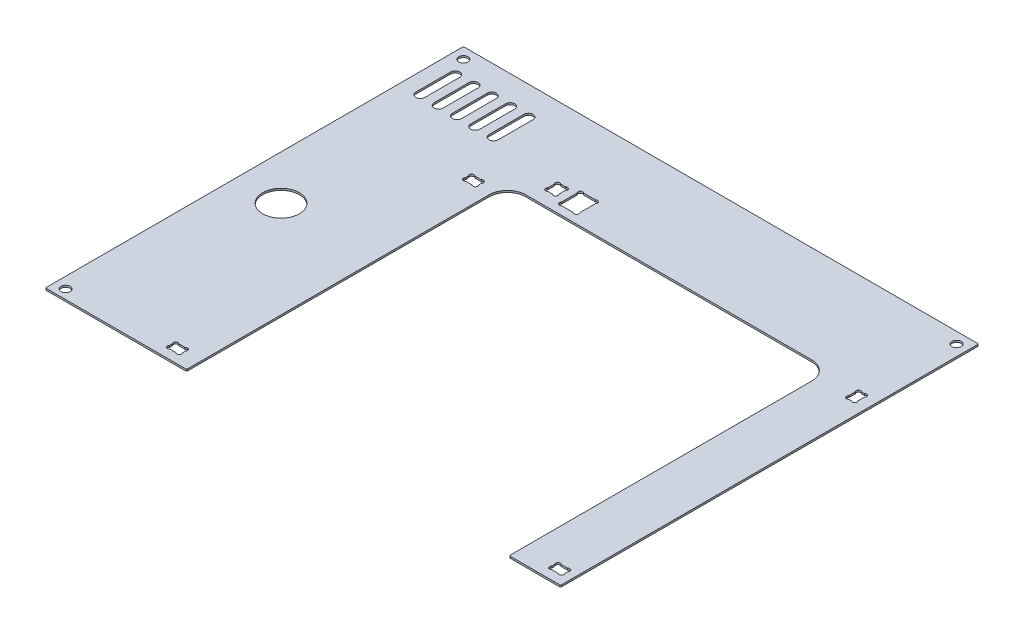
from build123d import *

# Parameters (mm, degrees)
SKETCH1_R           = 10
SKETCH1_R_2         = 2.5
SKETCH1_W           = 7
SKETCH1_H           = 5
SKETCH1_W_2         = 5
SKETCH1_H_2         = 7
BOSS_EXTRUDE1_DEPTH = 1
FILLET1_R           = 10
CUT_EXTRUDE3_DEPTH  = 362.864615568
SKETCH6_W           = 10
SKETCH6_H           = 12
CUT_EXTRUDE5_DEPTH  = 10
SKETCH7_W           = 6
SKETCH7_H           = 7
CUT_EXTRUDE6_DEPTH  = 362.864615568
SKETCH3_R           = 1.25
CUT_EXTRUDE2_DEPTH  = 362.864615568
FILLET2_R           = 0.5


with BuildPart() as part:
    # Sketch1 → Boss-Extrude1 (new body)
    with BuildSketch(Plane(origin=(0, 0, 0), x_dir=(1, 0, 0), z_dir=(0, 1, 0))):
        Polygon((77, 0), (77, 175), (253, 175), (253, 0), (281, 0), (281, 228), (0, 228), (0, 0), align=None)
        with Locations(Location((24.25, 104.25, 0), (0, 0, 270))):
            Circle(SKETCH1_R, mode=Mode.SUBTRACT)
        with Locations(Location((6, 222, 0), (0, 0, 270))):
            Circle(SKETCH1_R_2, mode=Mode.SUBTRACT)
        with Locations(Location((6, 5, 0), (0, 0, 270))):
            Circle(SKETCH1_R_2, mode=Mode.SUBTRACT)
        with Locations(Location((275, 222, 0), (0, 0, 270))):
            Circle(SKETCH1_R_2, mode=Mode.SUBTRACT)
        with Locations((273, 7.5)):
            Rectangle(SKETCH1_W, SKETCH1_H, mode=Mode.SUBTRACT)
        with Locations((272.5, 170)):
            Rectangle(SKETCH1_W_2, SKETCH1_H_2, mode=Mode.SUBTRACT)
        with Locations((64.5, 7.5)):
            Rectangle(SKETCH1_W, SKETCH1_H, mode=Mode.SUBTRACT)
        with Locations((66, 167.5)):
            Rectangle(SKETCH1_W, SKETCH1_H, mode=Mode.SUBTRACT)
    extrude(amount=BOSS_EXTRUDE1_DEPTH)

    # Fillet1
    fillet1_edges = [part.edges().sort_by_distance(p)[0] for p in [
        (253, 0.5, -175),
        (77, 0.5, -175),
    ]]
    fillet(fillet1_edges, radius=FILLET1_R)

    # Sketch4 → Cut-Extrude3 (cut, through all)
    with BuildSketch(Plane(origin=(0, 1, 0), x_dir=(1, 0, 0), z_dir=(0, 1, 0))):
        with BuildLine():
            Line((53.5, 212.5), (53.5, 193.5))
            ThreePointArc((53.5, 193.5), (51, 191), (48.5, 193.5))
            Line((48.5, 193.5), (48.5, 212.5))
            ThreePointArc((48.5, 212.5), (51, 215), (53.5, 212.5))
        make_face()
        with BuildLine():
            Line((43.5, 212.5), (43.5, 193.5))
            ThreePointArc((43.5, 193.5), (41, 191), (38.5, 193.5))
            Line((38.5, 193.5), (38.5, 212.5))
            ThreePointArc((38.5, 212.5), (41, 215), (43.5, 212.5))
        make_face()
        with BuildLine():
            Line((33.5, 212.5), (33.5, 193.5))
            ThreePointArc((33.5, 193.5), (31, 191), (28.5, 193.5))
            Line((28.5, 193.5), (28.5, 212.5))
            ThreePointArc((28.5, 212.5), (31, 215), (33.5, 212.5))
        make_face()
        with BuildLine():
            Line((23.5, 212.5), (23.5, 193.5))
            ThreePointArc((23.5, 193.5), (21, 191), (18.5, 193.5))
            Line((18.5, 193.5), (18.5, 212.5))
            ThreePointArc((18.5, 212.5), (21, 215), (23.5, 212.5))
        make_face()
        with BuildLine():
            Line((13.5, 212.5), (13.5, 193.5))
            ThreePointArc((13.5, 193.5), (11, 191), (8.5, 193.5))
            Line((8.5, 193.5), (8.5, 212.5))
            ThreePointArc((8.5, 212.5), (11, 215), (13.5, 212.5))
        make_face()
    extrude(amount=-CUT_EXTRUDE3_DEPTH, mode=Mode.SUBTRACT)

    # Sketch6 → Cut-Extrude5 (cut)
    with BuildSketch(Plane(origin=(0, 1, 0), x_dir=(1, 0, 0), z_dir=(0, 1, 0))):
        with Locations((105.19, 185.6)):
            Rectangle(SKETCH6_W, SKETCH6_H)
    extrude(amount=-CUT_EXTRUDE5_DEPTH, mode=Mode.SUBTRACT)

    # Sketch7 → Cut-Extrude6 (cut, through all)
    with BuildSketch(Plane(origin=(0, 1, 0), x_dir=(1, 0, 0), z_dir=(0, 1, 0))):
        with Locations((92.74, 186.1)):
            Rectangle(SKETCH7_W, SKETCH7_H)
    extrude(amount=-CUT_EXTRUDE6_DEPTH, mode=Mode.SUBTRACT)

    # Sketch3 → Cut-Extrude2 (cut, through all)
    with BuildSketch(Plane(origin=(0, 1, 0), x_dir=(1, 0, 0), z_dir=(0, 1, 0))):
        with Locations((275.616116524, 5.883883476)):
            Circle(SKETCH3_R)
        with Locations((275.616116524, 9.116116524)):
            Circle(SKETCH3_R)
        with Locations((270.383883476, 9.116116524)):
            Circle(SKETCH3_R)
        with Locations((270.383883476, 5.883883476)):
            Circle(SKETCH3_R)
        with Locations((274.116116524, 167.383883476)):
            Circle(SKETCH3_R)
        with Locations((270.883883476, 167.383883476)):
            Circle(SKETCH3_R)
        with Locations((274.116116524, 172.616116524)):
            Circle(SKETCH3_R)
        with Locations((270.883883476, 172.616116524)):
            Circle(SKETCH3_R)
        with Locations((67.116116524, 9.116116524)):
            Circle(SKETCH3_R)
        with Locations((67.116116524, 5.883883476)):
            Circle(SKETCH3_R)
        with Locations((61.883883476, 5.883883476)):
            Circle(SKETCH3_R)
        with Locations((61.883883476, 9.116116524)):
            Circle(SKETCH3_R)
        with Locations((63.383883476, 165.883883476)):
            Circle(SKETCH3_R)
        with Locations((63.383883476, 169.116116524)):
            Circle(SKETCH3_R)
        with Locations((68.616116524, 169.116116524)):
            Circle(SKETCH3_R)
        with Locations((68.616116524, 165.883883476)):
            Circle(SKETCH3_R)
        with Locations((90.62, 188.72)):
            Circle(SKETCH3_R)
        with Locations((94.86, 188.72)):
            Circle(SKETCH3_R)
        with Locations((90.62, 183.48)):
            Circle(SKETCH3_R)
        with Locations((94.86, 183.48)):
            Circle(SKETCH3_R)
        with Locations((101.073883476, 190.716116524)):
            Circle(SKETCH3_R)
        with Locations((109.306116524, 180.483883476)):
            Circle(SKETCH3_R)
        with Locations((109.306116524, 190.716116524)):
            Circle(SKETCH3_R)
        with Locations((101.073883476, 180.483883476)):
            Circle(SKETCH3_R)
    extrude(amount=-CUT_EXTRUDE2_DEPTH, mode=Mode.SUBTRACT)

    # Fillet2
    fillet2_edges = [part.edges().sort_by_distance(p)[0] for p in [
        (0, 0.5, 0),
        (0, 0.5, -228),
        (281, 0.5, -228),
        (281, 0.5, 0),
        (253, 0.5, 0),
        (77, 0.5, 0),
    ]]
    fillet(fillet2_edges, radius=FILLET2_R)


solid = part.part
